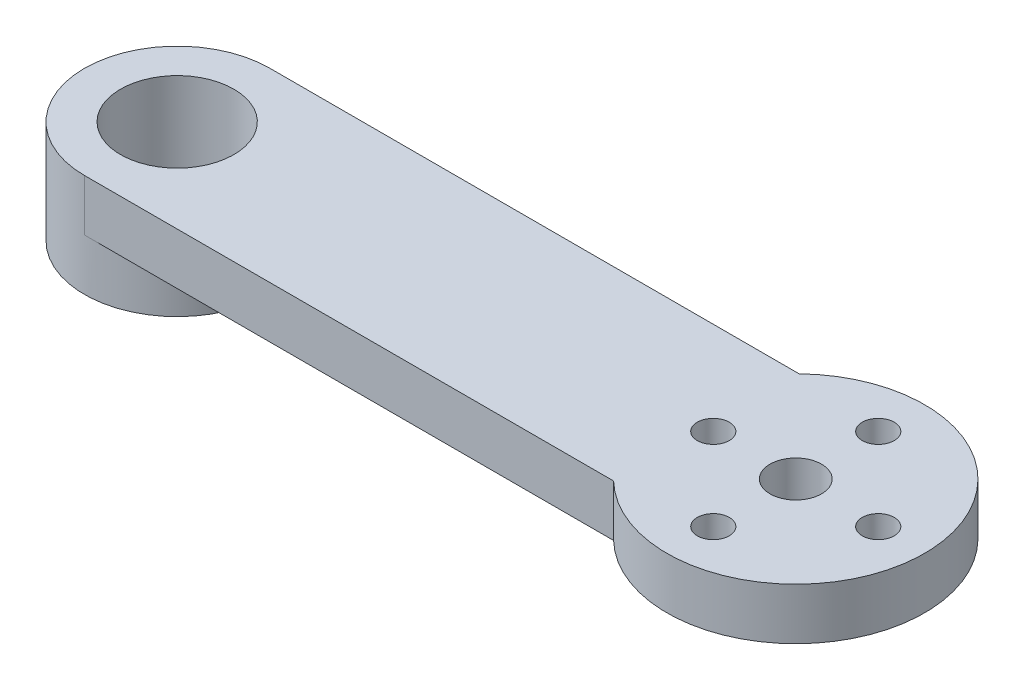
from build123d import *

# Parameters (mm, degrees)
BOSS_EXTRUDE1_DEPTH = 5
SKETCH2_R           = 2.5
CUT_EXTRUDE1_DEPTH  = 74.739406019
BOSS_EXTRUDE3_START = 5
SKETCH7_R           = 9
BOSS_EXTRUDE3_DEPTH = 5
SKETCH8_R           = 5.5
CUT_EXTRUDE3_DEPTH  = 75.246212025
SKETCH9_R           = 1.55
CUT_EXTRUDE4_DEPTH  = 74.739406019


with BuildPart() as part:
    # Sketch1 → Boss-Extrude1 (new body)
    with BuildSketch(Plane(origin=(0, 0, 0), x_dir=(1, 0, 0), z_dir=(0, 1, 0))):
        with BuildLine():
            Line((0, 9), (51.325324214, 9))
            ThreePointArc((51.325324214, 9), (72.5, 0), (51.325324214, -9))
            Line((51.325324214, -9), (0, -9))
            ThreePointArc((0, -9), (-9, 0), (0, 9))
        make_face()
    extrude(amount=BOSS_EXTRUDE1_DEPTH)

    # Sketch2 → Cut-Extrude1 (cut, through all)
    with BuildSketch(Plane(origin=(0, 5, 0), x_dir=(1, 0, 0), z_dir=(0, 1, 0))):
        with Locations(Location((60, 0, 0), (0, 0, 270))):
            Circle(SKETCH2_R)
    extrude(amount=-CUT_EXTRUDE1_DEPTH, mode=Mode.SUBTRACT)

    # Sketch7 → Boss-Extrude3 (add)
    with BuildSketch(Plane.XZ.offset(BOSS_EXTRUDE3_START)):
        with Locations(Location((0, 0, 0), (0, 0, 270))):
            Circle(SKETCH7_R)
    extrude(amount=-BOSS_EXTRUDE3_DEPTH)

    # Sketch8 → Cut-Extrude3 (cut, through all)
    with BuildSketch(Plane.XZ.offset(5)):
        with Locations(Location((0, 0, 0), (0, 0, 270))):
            Circle(SKETCH8_R)
    extrude(amount=-CUT_EXTRUDE3_DEPTH, mode=Mode.SUBTRACT)

    # Sketch9 → Cut-Extrude4 (cut, through all)
    with BuildSketch(Plane.XZ):
        with Locations(Location((60, 8, 0), (0, 0, 270))):
            Circle(SKETCH9_R)
        with Locations(Location((60, -8, 0), (0, 0, 270))):
            Circle(SKETCH9_R)
        with Locations(Location((68, 0, 0), (0, 0, 270))):
            Circle(SKETCH9_R)
        with Locations(Location((52, 0, 0), (0, 0, 270))):
            Circle(SKETCH9_R)
    extrude(amount=-CUT_EXTRUDE4_DEPTH, mode=Mode.SUBTRACT)


solid = part.part
